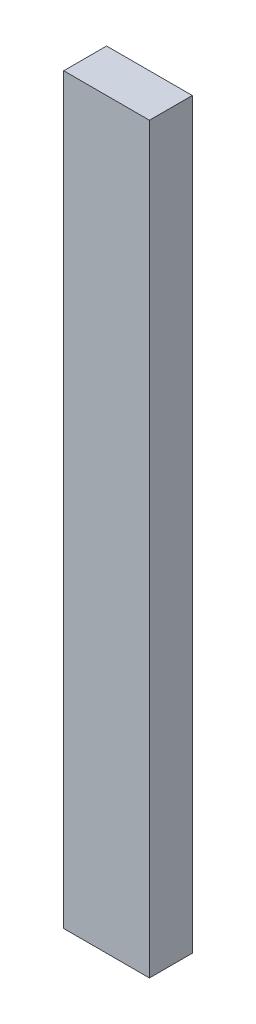
from build123d import *

# Parameters (mm, degrees)
SKETCH1_W           = 30
SKETCH1_H           = 15
BOSS_EXTRUDE1_DEPTH = 260


with BuildPart() as part:
    # Sketch1 → Boss-Extrude1 (new body)
    with BuildSketch(Plane(origin=(0, 0, 0), x_dir=(1, 0, 0), z_dir=(0, 1, 0))):
        with Locations((-33.647058824, -5.117647059)):
            Rectangle(SKETCH1_W, SKETCH1_H)
    extrude(amount=BOSS_EXTRUDE1_DEPTH)


solid = part.part
